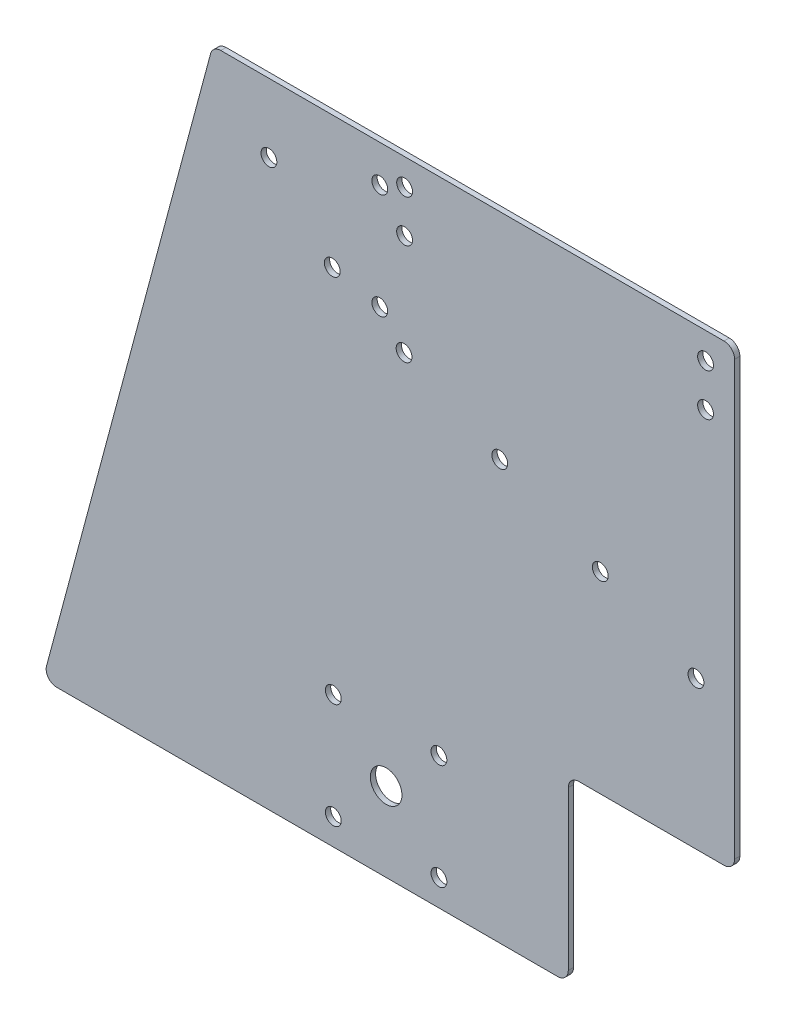
from build123d import *

# Parameters (mm, degrees)
SKETCH_1_R           = 1.5
SKETCH_1_R_2         = 3
EXTRUDE_1_DEPTH      = 1
SKETCH_2_W           = 46.5
SKETCH_2_H           = 120
EXTRUDE_2_DEPTH      = 1
SKETCH_7_R           = 1.5
CUT_EXTRUDE_5_DEPTH  = 10
SKETCH_8_R           = 1.5
CUT_EXTRUDE_6_DEPTH  = 10
SKETCH_10_W          = 51
SKETCH_10_H          = 30
CUT_EXTRUDE_7_DEPTH  = 10
SKETCH_11_R          = 1.5
CUT_EXTRUDE_8_DEPTH  = 65
SKETCH_12_R          = 1.5
CUT_EXTRUDE_9_DEPTH  = 10
SKETCH_13_W          = 41
SKETCH_13_H          = 30
CUT_EXTRUDE_10_DEPTH = 10
SKETCH_14_R          = 10
CUT_EXTRUDE_11_DEPTH = 10
SKETCH_16_R          = 1.5
CUT_EXTRUDE_13_DEPTH = 1
SKETCH_17_R          = 1.5
CUT_EXTRUDE_14_DEPTH = 10
SKETCH_18_W          = 92
SKETCH_18_H          = 4
CUT_EXTRUDE_15_DEPTH = 10
FILLET_2_R           = 2
SKETCH_19_R          = 10
EXTRUDE_3_DEPTH      = 1
SKETCH_20_W          = 60.5
SKETCH_20_H          = 86
CUT_EXTRUDE_16_DEPTH = 10
FILLET_3_R           = 2


with BuildPart() as part:
    # 草图1 → 凸台-拉伸1 (new body)
    with BuildSketch(Plane.XY):
        Polygon((0, 0), (-145, 0), (-112.846096908, 120), (0, 120), align=None)
        with Locations((-70, 25)):
            Circle(SKETCH_1_R, mode=Mode.SUBTRACT)
        with Locations((-90, 25)):
            Circle(SKETCH_1_R, mode=Mode.SUBTRACT)
        with Locations((-80, 15)):
            Circle(SKETCH_1_R_2, mode=Mode.SUBTRACT)
        with Locations((-70, 5)):
            Circle(SKETCH_1_R, mode=Mode.SUBTRACT)
        with Locations((-90, 5)):
            Circle(SKETCH_1_R, mode=Mode.SUBTRACT)
    extrude(amount=EXTRUDE_1_DEPTH)

    # 草图2 → 凸台-拉伸2 (add)
    with BuildSketch(Plane.XY.offset(1)):
        with Locations((23.25, 60)):
            Rectangle(SKETCH_2_W, SKETCH_2_H)
    extrude(amount=-EXTRUDE_2_DEPTH)

    # 草图7 → 切除-拉伸5 (cut)
    with BuildSketch(Plane.XY.offset(1)):
        with Locations((-102.2, 107)):
            Circle(SKETCH_7_R)
        with Locations((-90.2, 95)):
            Circle(SKETCH_7_R)
    extrude(amount=-CUT_EXTRUDE_5_DEPTH, mode=Mode.SUBTRACT)

    # 草图8 → 切除-拉伸6 (cut)
    with BuildSketch(Plane.XY.offset(1)):
        with Locations((42.5, 103)):
            Circle(SKETCH_8_R)
        with Locations((42.5, 83)):
            Circle(SKETCH_8_R)
    extrude(amount=-CUT_EXTRUDE_6_DEPTH, mode=Mode.SUBTRACT)

    # 草图10 → 切除-拉伸7 (cut)
    with BuildSketch(Plane.XY.offset(1)):
        with Locations((21, 15)):
            Rectangle(SKETCH_10_W, SKETCH_10_H)
    extrude(amount=-CUT_EXTRUDE_7_DEPTH, mode=Mode.SUBTRACT)

    # 草图11 → 切除-拉伸8 (cut)
    with BuildSketch(Plane(origin=(0, 0, 0), x_dir=(-1, 0, 0), z_dir=(0, 0, -1))):
        with Locations((76.599239768, 87.797222746)):
            Circle(SKETCH_11_R)
        with Locations((58.473084028, 79.344857511)):
            Circle(SKETCH_11_R)
        with Locations((21.314464759, 62.017508779)):
            Circle(SKETCH_11_R)
        with Locations((39.4406205, 70.469874014)):
            Circle(SKETCH_11_R)
    extrude(amount=-CUT_EXTRUDE_8_DEPTH, mode=Mode.SUBTRACT)

    # 草图12 → 切除-拉伸9 (cut)
    with BuildSketch(Plane(origin=(0, 0, 0), x_dir=(-1, 0, 0), z_dir=(0, 0, -1))):
        with Locations((81.2, 113)):
            Circle(SKETCH_12_R)
        with Locations((81.2, 93)):
            Circle(SKETCH_12_R)
    extrude(amount=-CUT_EXTRUDE_9_DEPTH, mode=Mode.SUBTRACT)

    # 草图13 → 切除-拉伸10 (cut)
    with BuildSketch(Plane(origin=(0, 0, 0), x_dir=(-1, 0, 0), z_dir=(0, 0, -1))):
        with Locations((25, 15)):
            Rectangle(SKETCH_13_W, SKETCH_13_H)
    extrude(amount=-CUT_EXTRUDE_10_DEPTH, mode=Mode.SUBTRACT)

    # 草图14 → 切除-拉伸11 (cut)
    with BuildSketch(Plane(origin=(0, 0, 0), x_dir=(-1, 0, 0), z_dir=(0, 0, -1))):
        with Locations((-28.5, 104)):
            Circle(SKETCH_14_R)
    extrude(amount=-CUT_EXTRUDE_11_DEPTH, mode=Mode.SUBTRACT)

    # 草图16 → 切除-拉伸13 (cut)
    with BuildSketch(Plane(origin=(0, 0, 0), x_dir=(-1, 0, 0), z_dir=(0, 0, -1))):
        with Locations((76.5, 115)):
            Circle(SKETCH_16_R)
        with Locations((76.5, 107)):
            Circle(SKETCH_16_R)
        with Locations((19.5, 107)):
            Circle(SKETCH_16_R)
        with Locations((19.5, 115)):
            Circle(SKETCH_16_R)
    extrude(amount=-CUT_EXTRUDE_13_DEPTH, mode=Mode.SUBTRACT)

    # 草图17 → 切除-拉伸14 (cut)
    with BuildSketch(Plane(origin=(0, 0, 0), x_dir=(-1, 0, 0), z_dir=(0, 0, -1))):
        with Locations((-14.5, 115)):
            Circle(SKETCH_17_R)
        with Locations((-34.5, 115)):
            Circle(SKETCH_17_R)
    extrude(amount=-CUT_EXTRUDE_14_DEPTH, mode=Mode.SUBTRACT)

    # 草图18 → 切除-拉伸15 (cut)
    with BuildSketch(Plane(origin=(0, 0, 0), x_dir=(-1, 0, 0), z_dir=(0, 0, -1))):
        with Locations((-0.5, 32)):
            Rectangle(SKETCH_18_W, SKETCH_18_H)
    extrude(amount=-CUT_EXTRUDE_15_DEPTH, mode=Mode.SUBTRACT)

    # 圆角2
    fillet_2_edges = [part.edges().sort_by_distance(p)[0] for p in [
        (-45.5, 0, 0.5),
        (46.5, 34, 0.5),
        (-45.5, 34, 0.5),
        (46.5, 120, 0.5),
        (-145, 0, 0.5),
        (-112.846096908, 120, 0.5),
    ]]
    fillet(fillet_2_edges, radius=FILLET_2_R)

    # 草图19 → 凸台-拉伸3 (add)
    with BuildSketch(Plane(origin=(0, 0, 0), x_dir=(-1, 0, 0), z_dir=(0, 0, -1))):
        with Locations((-28.5, 104)):
            Circle(SKETCH_19_R)
    extrude(amount=-EXTRUDE_3_DEPTH)

    # 草图20 → 切除-拉伸16 (cut)
    with BuildSketch(Plane(origin=(0, 0, 0), x_dir=(-1, 0, 0), z_dir=(0, 0, -1))):
        with Locations((-16.25, 77)):
            Rectangle(SKETCH_20_W, SKETCH_20_H)
    extrude(amount=-CUT_EXTRUDE_16_DEPTH, mode=Mode.SUBTRACT)

    # 圆角3
    fillet_3_edges = [part.edges().sort_by_distance(p)[0] for p in [
        (-14, 120, 0.5),
        (-14, 34, 0.5),
    ]]
    fillet(fillet_3_edges, radius=FILLET_3_R)


solid = part.part
